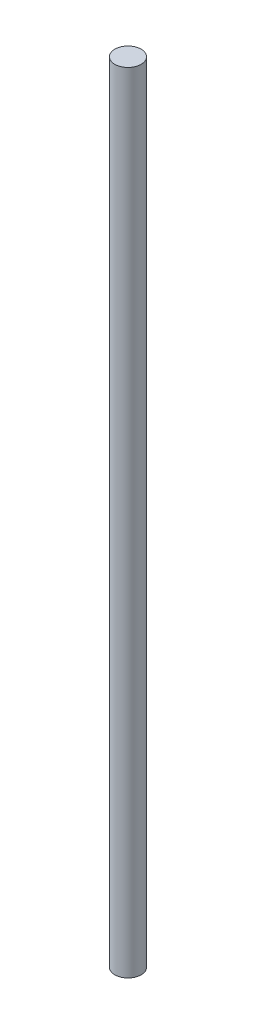
from build123d import *

# Parameters (mm, degrees)
SKETCH1_R           = 2.5
BOSS_EXTRUDE1_DEPTH = 75


with BuildPart() as part:
    # Sketch1 → Boss-Extrude1 (new, symmetric)
    with BuildSketch(Plane(origin=(0, 0, 0), x_dir=(1, 0, 0), z_dir=(0, 1, 0))):
        with Locations(Location((0, 0, 0), (0, 0, 270))):
            Circle(SKETCH1_R)
    extrude(amount=BOSS_EXTRUDE1_DEPTH, both=True)


solid = part.part
